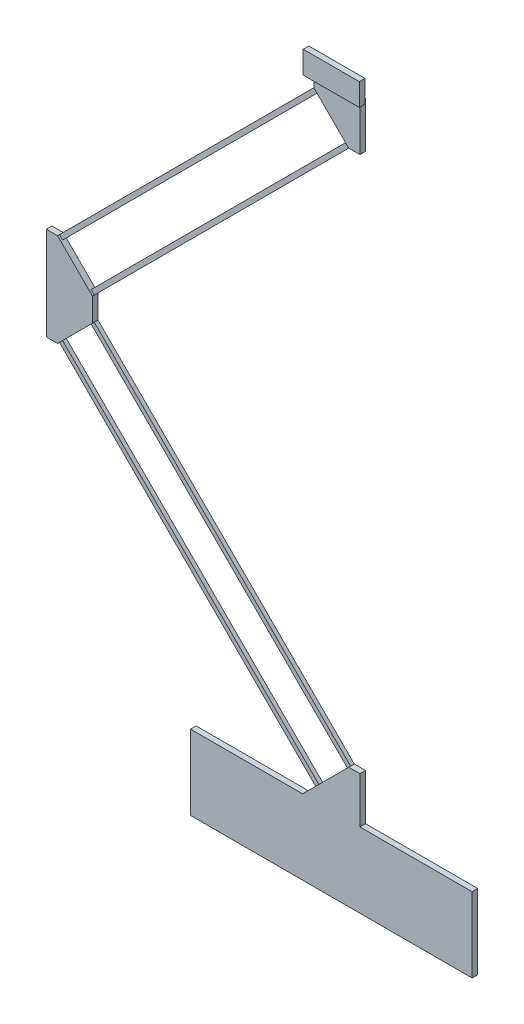
from build123d import *

# Parameters (mm, degrees)
EXTRUDE_THIN1_DEPTH   = 10
EXTRUDE_THIN1_2_DEPTH = 10
BOSS_EXTRUDE1_DEPTH   = 15
BOSS_EXTRUDE2_DEPTH   = 15
BOSS_EXTRUDE3_DEPTH   = 15
SKETCH5_W             = 150
SKETCH5_H             = 60
BOSS_EXTRUDE4_DEPTH   = 15


with BuildPart() as part:
    # Sketch1 → Extrude-Thin1 (new body)
    with BuildSketch(Plane.XY):
        Polygon((-707.106781187, 715.592062561), (8.485281374, 0), (-84.852813742, -93.338095117), (-800.444876303, 622.253967444), align=None)
        Polygon((-707.106781187, 698.621499812), (-8.485281374, 0), (-84.852813742, -76.367532368), (-783.474313555, 622.253967444), align=None, mode=Mode.SUBTRACT)
    extrude(amount=EXTRUDE_THIN1_DEPTH)



with BuildPart() as body_2:
    # Sketch1 → Extrude-Thin1 2 (new body)
    with BuildSketch(Plane.XY):
        Polygon((8.485281374, 1464.213562373), (-707.106781187, 748.621499812), (-800.444876303, 841.959594929), (-84.852813742, 1557.55165749), align=None)
        Polygon((-8.485281374, 1464.213562373), (-707.106781187, 765.592062561), (-783.474313555, 841.959594929), (-84.852813742, 1540.581094741), align=None, mode=Mode.SUBTRACT)
    extrude(amount=EXTRUDE_THIN1_2_DEPTH)


with BuildPart() as part_1:
    add(part.part)

    add(body_2.part)  # Boss-Extrude1 merges body 2
    # Sketch2 → Boss-Extrude1 (add)
    with BuildSketch(Plane.XY):
        Polygon((-692.106781187, 732.106781187), (-815.444876303, 732.106781187), (-815.444876303, 607.253967444), (-785.444876303, 607.253967444), (-692.106781187, 700.592062561), align=None)
        Polygon((-785.444876303, 856.959594929), (-815.444876303, 856.959594929), (-815.444876303, 732.106781187), (-692.106781187, 732.106781187), (-692.106781187, 763.621499812), align=None)
    extrude(amount=BOSS_EXTRUDE1_DEPTH)

    # Sketch3 → Boss-Extrude2 (add)
    with BuildSketch(Plane.XY):
        Polygon((-129.852813742, -108.338095117), (-6.514718626, 15), (23.485281374, 15), (23.485281374, -108.338095117), (323.485281374, -108.338095117), (323.485281374, -308.338095117), (-429.852813742, -308.338095117), (-429.852813742, -108.338095117), align=None)
    extrude(amount=BOSS_EXTRUDE2_DEPTH)

    # Sketch4 → Boss-Extrude3 (add)
    with BuildSketch(Plane.XY):
        Polygon((-99.852813742, 1572.55165749), (-99.852813742, 1542.55165749), (-6.514718626, 1449.213562373), (23.485281374, 1449.213562373), (23.485281374, 1572.55165749), align=None)
    extrude(amount=BOSS_EXTRUDE3_DEPTH)


with BuildPart() as body_2_2:
    # Sketch5 → Boss-Extrude4 (new body)
    with BuildSketch(Plane.XY.offset(15)):
        with Locations((-38.183766184, 1602.55165749)):
            Rectangle(SKETCH5_W, SKETCH5_H)
    extrude(amount=BOSS_EXTRUDE4_DEPTH)


solid = Compound([part_1.part, body_2_2.part])
